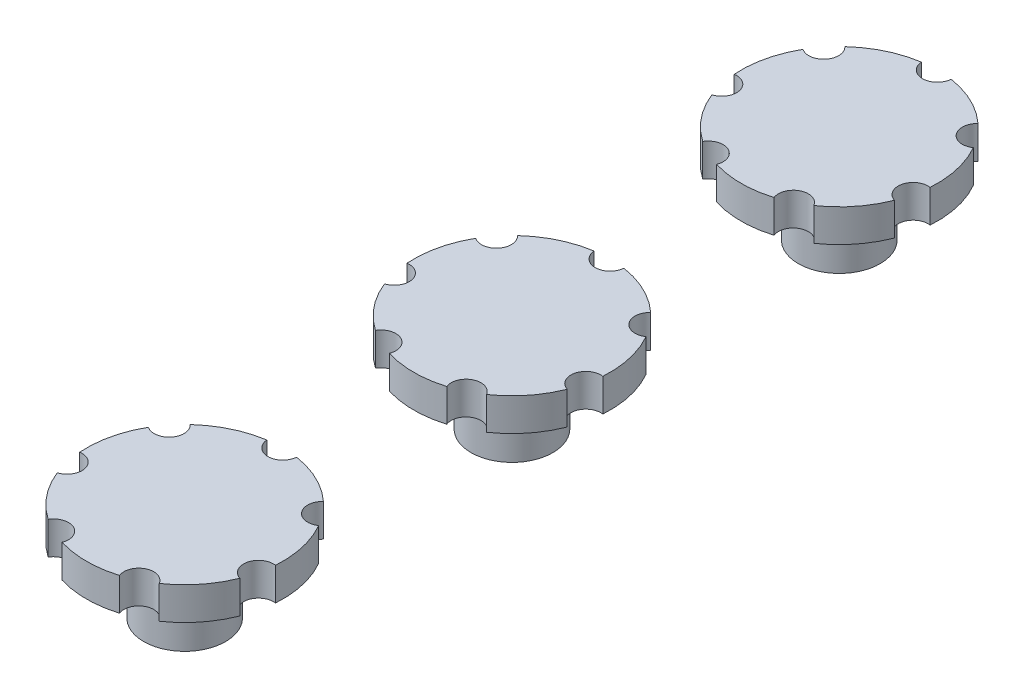
from build123d import *

# Parameters (mm, degrees)
BOSS_EXTRUDE1_START = 2
BOSS_EXTRUDE1_DEPTH = 1
BOSS_EXTRUDE2_DEPTH = 2
LPATTERN1_COUNT     = 3
LPATTERN1_PITCH     = 10


with BuildPart() as part:
    # Sketch1 → Boss-Extrude1 (new body)
    with BuildSketch(Plane(origin=(0, 0, 0), x_dir=(1, 0, 0), z_dir=(0, 1, 0)).offset(BOSS_EXTRUDE1_START)):
        with BuildLine():
            ThreePointArc((0.454873281, 2.965314536), (0.310072161, 2.665383744), (0, 2.5438062))
            ThreePointArc((0, 2.5438062), (-0.310072161, 2.665383744), (-0.454873281, 2.965314536))
            ThreePointArc((-0.454873281, 2.965314536), (-1.301651217, 2.702906604), (-2.034767408, 2.204477624))
            ThreePointArc((-2.034767408, 2.204477624), (-1.988827772, 1.586037223), (-2.601985112, 1.493209121))
            ThreePointArc((-2.601985112, 1.493209121), (-2.924783737, 0.667562802), (-2.992186737, -0.216375902))
            ThreePointArc((-2.992186737, -0.216375902), (-2.480027667, -0.566050131), (-2.789749082, -1.103313218))
            ThreePointArc((-2.789749082, -1.103313218), (-2.345494447, -1.870469406), (-1.696428424, -2.47429396))
            ThreePointArc((-1.696428424, -2.47429396), (-1.103716146, -2.291890192), (-0.876775093, -2.869018201))
            ThreePointArc((-0.876775093, -2.869018201), (0, -3), (0.876775093, -2.869018201))
            ThreePointArc((0.876775093, -2.869018201), (1.103716146, -2.291890192), (1.696428424, -2.47429396))
            ThreePointArc((1.696428424, -2.47429396), (2.345494447, -1.870469406), (2.789749082, -1.103313218))
            ThreePointArc((2.789749082, -1.103313218), (2.480027667, -0.566050131), (2.992186737, -0.216375902))
            ThreePointArc((2.992186737, -0.216375902), (2.924783737, 0.667562802), (2.601985112, 1.493209121))
            ThreePointArc((2.601985112, 1.493209121), (1.988827772, 1.586037223), (2.034767408, 2.204477624))
            ThreePointArc((2.034767408, 2.204477624), (1.301651217, 2.702906604), (0.454873281, 2.965314536))
        make_face()
    extrude(amount=BOSS_EXTRUDE1_DEPTH)

    # Sketch1<28> → Boss-Extrude2 (add)
    with BuildSketch(Plane(origin=(0, 0, 0), x_dir=(1, 0, 0), z_dir=(0, 1, 0))):
        with BuildLine():
            ThreePointArc((1.25, 0), (0.883883476, 0.883883476), (0, 1.25))
            ThreePointArc((0, 1.25), (-0.883883476, -0.883883476), (1.25, 0))
        make_face()
        with BuildLine():
            ThreePointArc((0.6, 0), (-0.424264069, -0.424264069), (0, 0.6))
            ThreePointArc((0, 0.6), (0.424264069, 0.424264069), (0.6, 0))
        make_face(mode=Mode.SUBTRACT)
    extrude(amount=BOSS_EXTRUDE2_DEPTH)


with BuildPart() as lpattern1_1:
    # LPattern1: pattern copy
    add(part.part.moved(Location(Vector(0, 0, -1) * (1 * LPATTERN1_PITCH))))


with BuildPart() as lpattern1_2:
    # LPattern1: pattern copy
    add(part.part.moved(Location(Vector(0, 0, -1) * (2 * LPATTERN1_PITCH))))


solid = Compound([part.part, lpattern1_1.part, lpattern1_2.part])
